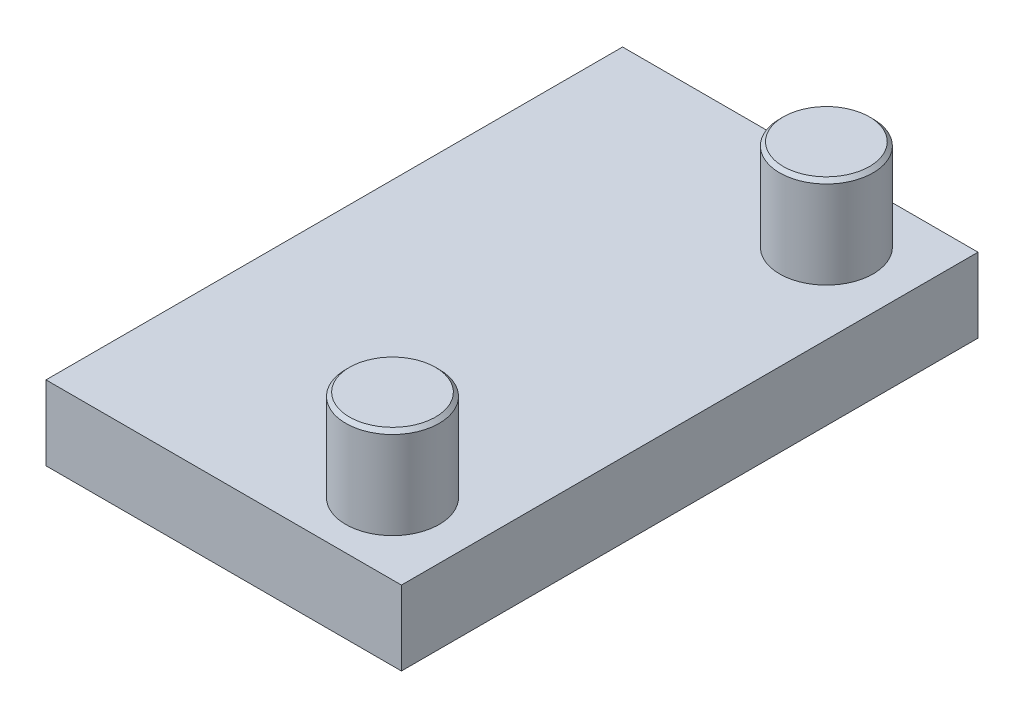
from build123d import *

# Parameters (mm, degrees)
SKETCH1_W           = 12.3698
SKETCH1_H           = 20.066
BOSS_EXTRUDE1_DEPTH = 2.5908
SKETCH2_R           = 1.6256
BOSS_EXTRUDE2_DEPTH = 3.175
CHAMFER1_SIZE       = 0.127


with BuildPart() as part:
    # Sketch1 → Boss-Extrude1 (new body)
    with BuildSketch(Plane(origin=(0, 0, 0), x_dir=(1, 0, 0), z_dir=(0, 1, 0))):
        Rectangle(SKETCH1_W, SKETCH1_H)
    extrude(amount=BOSS_EXTRUDE1_DEPTH)

    # Sketch2 → Boss-Extrude2 (add)
    with BuildSketch(Plane(origin=(0, 2.5908, 0), x_dir=(1, 0, 0), z_dir=(0, 1, 0))):
        with Locations(Location((3.3909, 7.55015, 0), (0, 0, 270))):
            Circle(SKETCH2_R)
        with Locations(Location((3.3909, -7.55015, 0), (0, 0, 90))):
            Circle(SKETCH2_R)
    extrude(amount=BOSS_EXTRUDE2_DEPTH)

    # Chamfer1
    chamfer1_edges = [part.edges().sort_by_distance(p)[0] for p in [
        (3.3909, 5.7658, -9.17575),
        (3.3909, 5.7658, 9.17575),
    ]]
    chamfer(chamfer1_edges, length=CHAMFER1_SIZE)


solid = part.part
